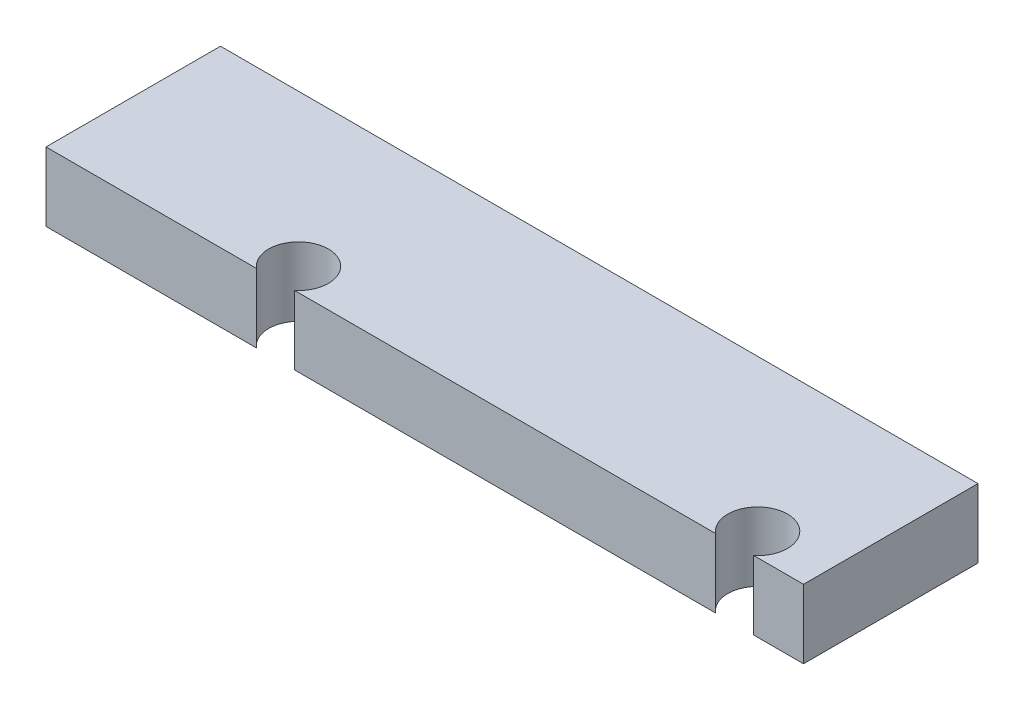
from build123d import *

# Parameters (mm, degrees)
SKETCH1_W           = 165
SKETCH1_H           = 38
BOSS_EXTRUDE1_DEPTH = 7.5
SKETCH2_R           = 6.5
CUT_EXTRUDE1_DEPTH  = 86.97819491


with BuildPart() as part:
    # Sketch1 → Boss-Extrude1 (new, symmetric)
    with BuildSketch(Plane(origin=(0, 0, 0), x_dir=(1, 0, 0), z_dir=(0, 1, 0))):
        Rectangle(SKETCH1_W, SKETCH1_H)
    extrude(amount=BOSS_EXTRUDE1_DEPTH, both=True)

    # Sketch2 → Cut-Extrude1 (cut, through all)
    with BuildSketch(Plane(origin=(0, 7.5, 0), x_dir=(1, 0, 0), z_dir=(0, 1, 0))):
        with Locations((67.5, -14)):
            Circle(SKETCH2_R)
        with Locations((-32.5, -14)):
            Circle(SKETCH2_R)
    extrude(amount=-CUT_EXTRUDE1_DEPTH, mode=Mode.SUBTRACT)


solid = part.part
